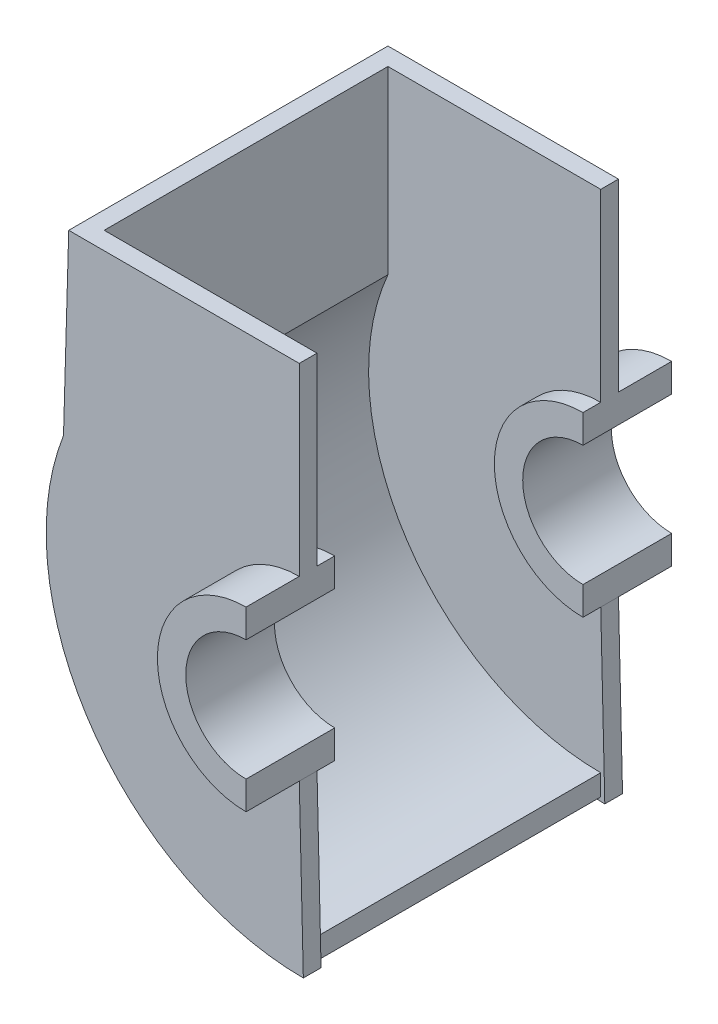
from build123d import *

# Parameters (mm, degrees)
BOSS_EXTRUDE1_DEPTH      = 508
BOSS_EXTRUDE1_DEPTH_BACK = 127
BOSS_EXTRUDE2_DEPTH      = 127
EXTRUDE_THIN1_DEPTH      = 2032


with BuildPart() as part:
    # Sketch1 → Boss-Extrude1 (new, two sides: drawn at the far end of the back side and taken through both)
    with BuildSketch(Plane.XY.offset(-BOSS_EXTRUDE1_DEPTH_BACK)):
        with BuildLine():
            Line((0, 635), (0, 431.8))
            ThreePointArc((0, 431.8), (-431.8, 0), (0, -431.8))
            Line((0, -431.8), (0, -635))
            ThreePointArc((0, -635), (-635, 0), (0, 635))
        make_face()
    extrude(amount=BOSS_EXTRUDE1_DEPTH + BOSS_EXTRUDE1_DEPTH_BACK)

    # Sketch3 → Boss-Extrude2 (add)
    with BuildSketch(Plane.XY):
        with BuildLine():
            ThreePointArc((0, 635), (-606.566566409, 0), (0, -635))
            Line((0, -635), (29.099856858, -1841.5))
            ThreePointArc((29.099856858, -1841.5), (-1489.845114235, -1041.118833174), (-1688.415446927, 664.276622547))
            Line((-1688.415446927, 664.276622547), (-1651, 1955.8))
            Line((-1651, 1955.8), (0, 1955.8))
            Line((0, 1955.8), (0, 635))
        make_face()
    extrude(amount=BOSS_EXTRUDE2_DEPTH)


with BuildPart() as body_2:
    # Mirror1: mirrored copy
    add(part.part.mirror(Plane.XY.offset(-1016)))


with BuildPart() as part_1:
    add(part.part)

    add(body_2.part)  # Extrude-Thin1 merges body 2
    # Sketch4 → Extrude-Thin1 (add)
    with BuildSketch(Plane.XY.offset(-2032)):
        with BuildLine():
            Line((-1688.415446927, 664.276622547), (-1651, 1955.8))
            Line((-1651, 1955.8), (-1524, 1955.8))
            Line((-1524, 1955.8), (-1524, 664.276622547))
            ThreePointArc((-1524, 664.276622547), (-1390.716715754, -910.904192429), (0, -1662.479904018))
            Line((0, -1662.479904018), (0, -1812.400143142))
            Line((0, -1812.400143142), (-2.54, -1812.400143142))
            Line((-2.54, -1812.400143142), (-2.54, -1665.017966622))
            ThreePointArc((-2.54, -1665.017966622), (-1393.391992742, -911.454900332), (-1526.54, 664.805918427))
            Line((-1526.54, 664.805918427), (-1526.54, 1953.26))
            Line((-1526.54, 1953.26), (-1648.53251819, 1953.26))
            Line((-1648.53251819, 1953.26), (-1685.876512119, 664.203069577))
            Line((-1685.876512119, 664.203069577), (-1688.415446927, 664.276622547))
        make_face()
    extrude(amount=EXTRUDE_THIN1_DEPTH)


solid = part_1.part
